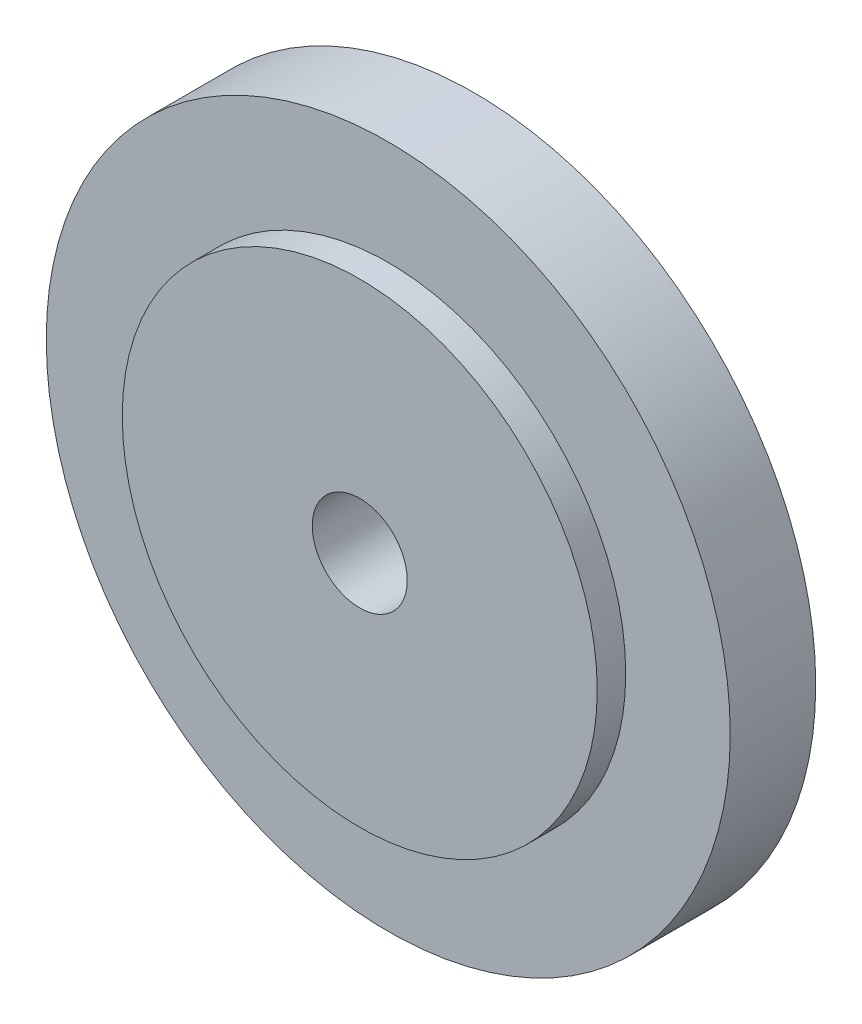
from build123d import *

# Parameters (mm, degrees)
SKETCH1_R           = 18
BOSS_EXTRUDE1_DEPTH = 4.5
SKETCH2_R           = 12.5
BOSS_EXTRUDE2_DEPTH = 1.5
SKETCH3_R           = 2.5
CUT_EXTRUDE1_DEPTH  = 27.153393661


with BuildPart() as part:
    # Sketch1 → Boss-Extrude1 (new body)
    with BuildSketch(Plane.XY):
        Circle(SKETCH1_R)
    extrude(amount=BOSS_EXTRUDE1_DEPTH)

    # Sketch2 → Boss-Extrude2 (add)
    with BuildSketch(Plane.XY.offset(4.5)):
        Circle(SKETCH2_R)
    extrude(amount=BOSS_EXTRUDE2_DEPTH)

    # Sketch3 → Cut-Extrude1 (cut, through all)
    with BuildSketch(Plane.XY.offset(6)):
        Circle(SKETCH3_R)
    extrude(amount=-CUT_EXTRUDE1_DEPTH, mode=Mode.SUBTRACT)


solid = part.part
